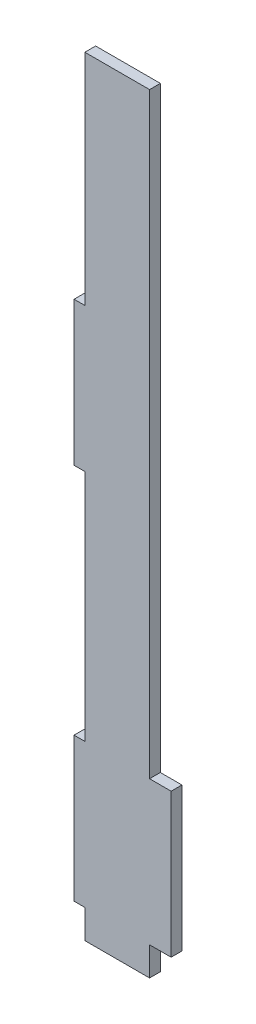
from build123d import *

# Parameters (mm, degrees)
SKETCH1_W           = 18
SKETCH1_H           = 61
BASE_SHAPE_DEPTH    = 3
SKETCH2_W           = 6
SKETCH2_H           = 40
SKETCH2_W_2         = 3
FINGERS_DEPTH       = 3
SKETCH3_W           = 18
SKETCH3_H           = 3
BOSS_EXTRUDE1_DEPTH = 153
SKETCH4_W           = 3
SKETCH4_H           = 40
BOSS_EXTRUDE3_DEPTH = 3


with BuildPart() as part:
    # Sketch1 → Base Shape (new body)
    with BuildSketch(Plane.XY):
        with Locations((-9, 30.5)):
            Rectangle(SKETCH1_W, SKETCH1_H)
    extrude(amount=BASE_SHAPE_DEPTH)

    # Sketch2 → Fingers (add)
    with BuildSketch(Plane.XY.offset(3)):
        with Locations((3, 28)):
            Rectangle(SKETCH2_W, SKETCH2_H)
        with Locations((-19.5, 28)):
            Rectangle(SKETCH2_W_2, SKETCH2_H)
    extrude(amount=-FINGERS_DEPTH)

    # Sketch3 → Boss-Extrude1 (add)
    with BuildSketch(Plane(origin=(0, 61, 0), x_dir=(1, 0, 0), z_dir=(0, 1, 0))):
        with Locations((-9, -1.5)):
            Rectangle(SKETCH3_W, SKETCH3_H)
    extrude(amount=BOSS_EXTRUDE1_DEPTH)

    # Sketch4 → Boss-Extrude3 (add, through all)
    with BuildSketch(Plane.XY.offset(3)):
        with Locations((-19.5, 133)):
            Rectangle(SKETCH4_W, SKETCH4_H)
    extrude(amount=-BOSS_EXTRUDE3_DEPTH)


solid = part.part
